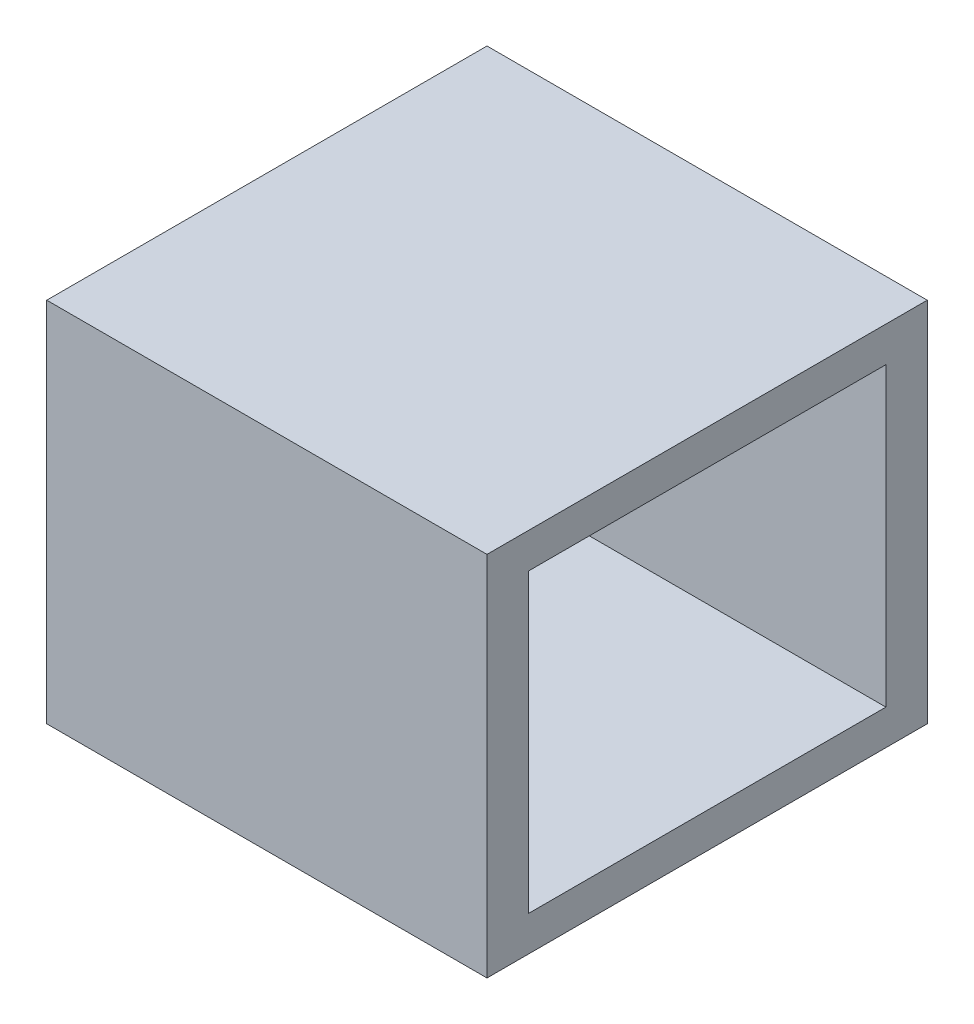
from build123d import *

# Parameters (mm, degrees)
SKETCH1_W           = 152.4
SKETCH1_H           = 127
BOSS_EXTRUDE1_DEPTH = 76.2
SKETCH3_W           = 123.769027692
SKETCH3_H           = 102.663904472
CUT_EXTRUDE2_DEPTH  = 182.836327504


with BuildPart() as part:
    # Sketch1 → Boss-Extrude1 (new, symmetric)
    with BuildSketch(Plane.XY):
        Rectangle(SKETCH1_W, SKETCH1_H)
    extrude(amount=BOSS_EXTRUDE1_DEPTH, both=True)

    # Sketch3 → Cut-Extrude2 (cut, through all)
    with BuildSketch(Plane(origin=(76.2, 0, 0), x_dir=(0, 0, -1), z_dir=(1, 0, 0))):
        Rectangle(SKETCH3_W, SKETCH3_H)
    extrude(amount=-CUT_EXTRUDE2_DEPTH, mode=Mode.SUBTRACT)


solid = part.part
